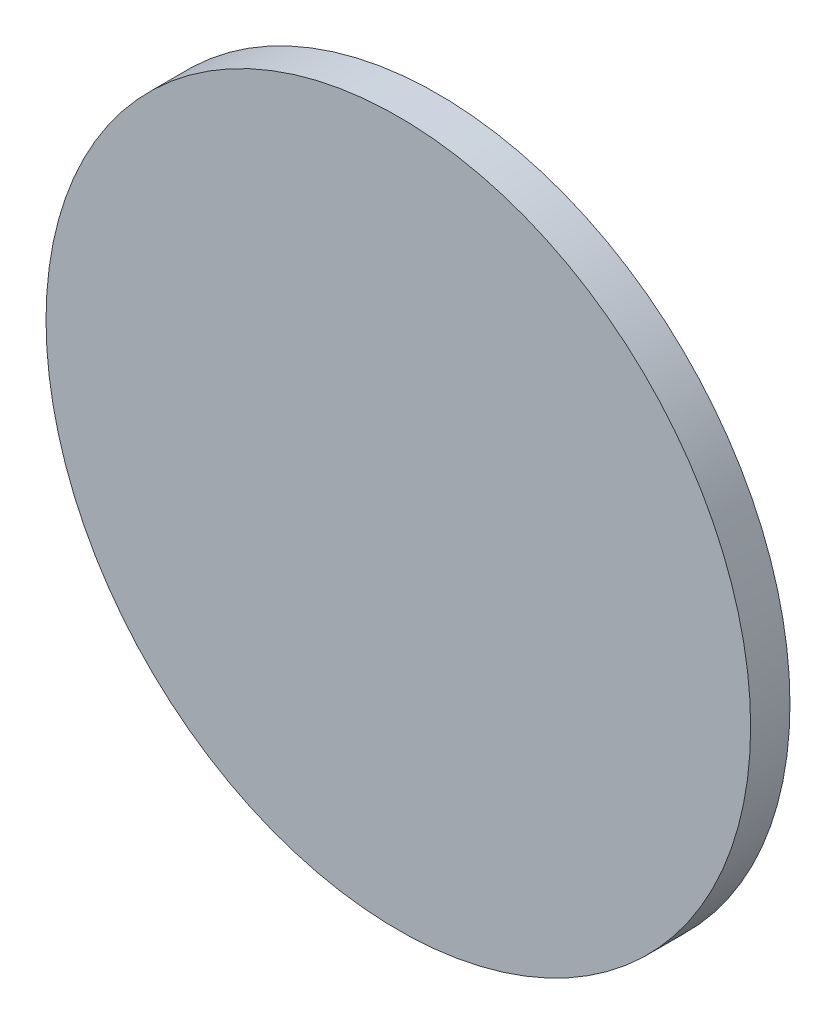
from build123d import *

# Parameters (mm, degrees)
SKETCH1_R           = 22.75
BOSS_EXTRUDE1_DEPTH = 2.54


with BuildPart() as part:
    # Sketch1 → Boss-Extrude1 (new body)
    with BuildSketch(Plane.XY):
        Circle(SKETCH1_R)
    extrude(amount=BOSS_EXTRUDE1_DEPTH)


solid = part.part
